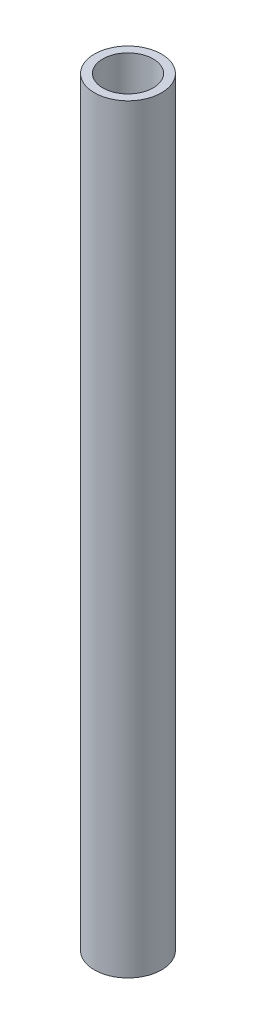
from build123d import *

# Parameters (mm, degrees)
SKETCH1_R           = 4
SKETCH1_R_2         = 3
BOSS_EXTRUDE1_DEPTH = 90.5


with BuildPart() as part:
    # Sketch1 → Boss-Extrude1 (new body)
    with BuildSketch(Plane(origin=(0, 0, 0), x_dir=(1, 0, 0), z_dir=(0, 1, 0))):
        with Locations(Location((0, 0, 0), (0, 0, 270))):
            Circle(SKETCH1_R)
        with Locations(Location((0, 0, 0), (0, 0, 270))):
            Circle(SKETCH1_R_2, mode=Mode.SUBTRACT)
    extrude(amount=BOSS_EXTRUDE1_DEPTH)


solid = part.part
